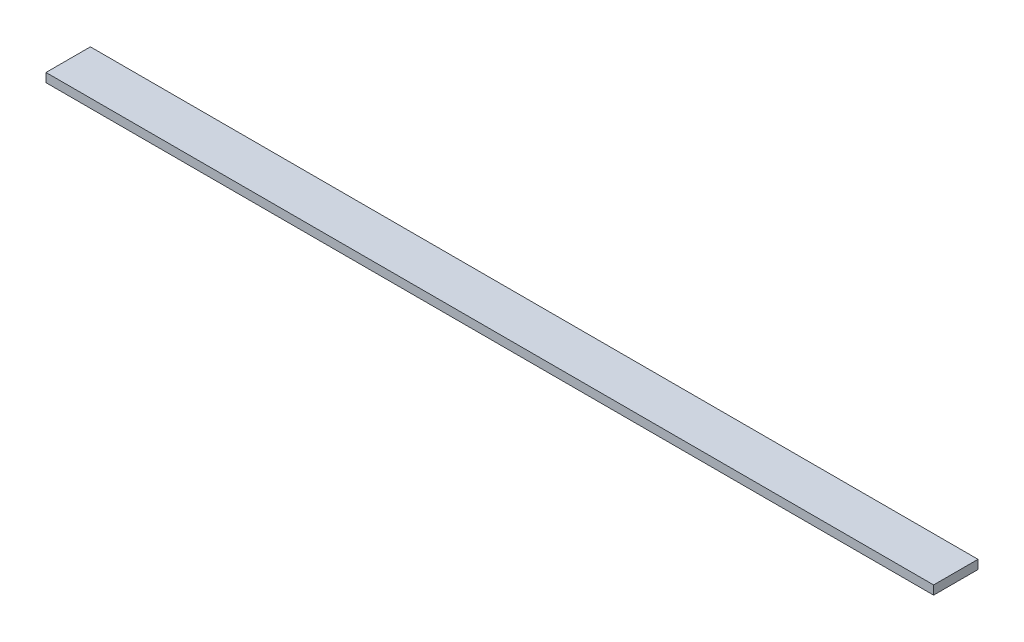
from build123d import *

# Parameters (mm, degrees)
PACK_SARJOR_ALT_TUTUCU_RAY_2_1_START = -20
SKETCH1_W                            = 400
SKETCH1_H                            = 4
PACK_SARJOR_ALT_TUTUCU_RAY_2_1_DEPTH = 20


with BuildPart() as part:
    # Sketch1 → PACK_sarjor_alt_tutucu_ray_2_1 (new body)
    with BuildSketch(Plane.XY.offset(PACK_SARJOR_ALT_TUTUCU_RAY_2_1_START)):
        with Locations((350, 1042)):
            Rectangle(SKETCH1_W, SKETCH1_H)
    extrude(amount=-PACK_SARJOR_ALT_TUTUCU_RAY_2_1_DEPTH)


solid = part.part
